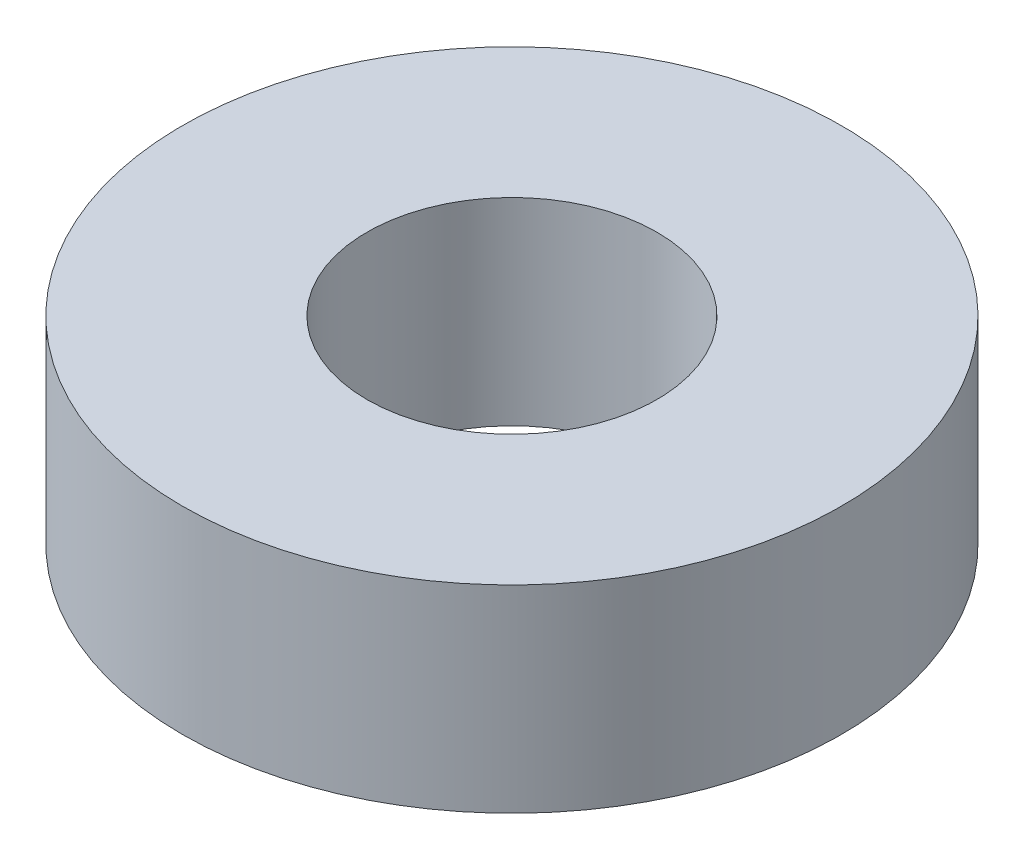
from build123d import *

# Parameters (mm, degrees)
SKETCH_1_R      = 2.5
SKETCH_1_R_2    = 1.1
EXTRUDE_1_DEPTH = 1.5


with BuildPart() as part:
    # 草图1 → 凸台-拉伸1 (new body)
    with BuildSketch(Plane(origin=(0, 0, 0), x_dir=(1, 0, 0), z_dir=(0, 1, 0))):
        with Locations(Location((0, 0, 0), (0, 0, 270))):
            Circle(SKETCH_1_R)
        with Locations(Location((0, 0, 0), (0, 0, 270))):
            Circle(SKETCH_1_R_2, mode=Mode.SUBTRACT)
    extrude(amount=EXTRUDE_1_DEPTH)


solid = part.part
